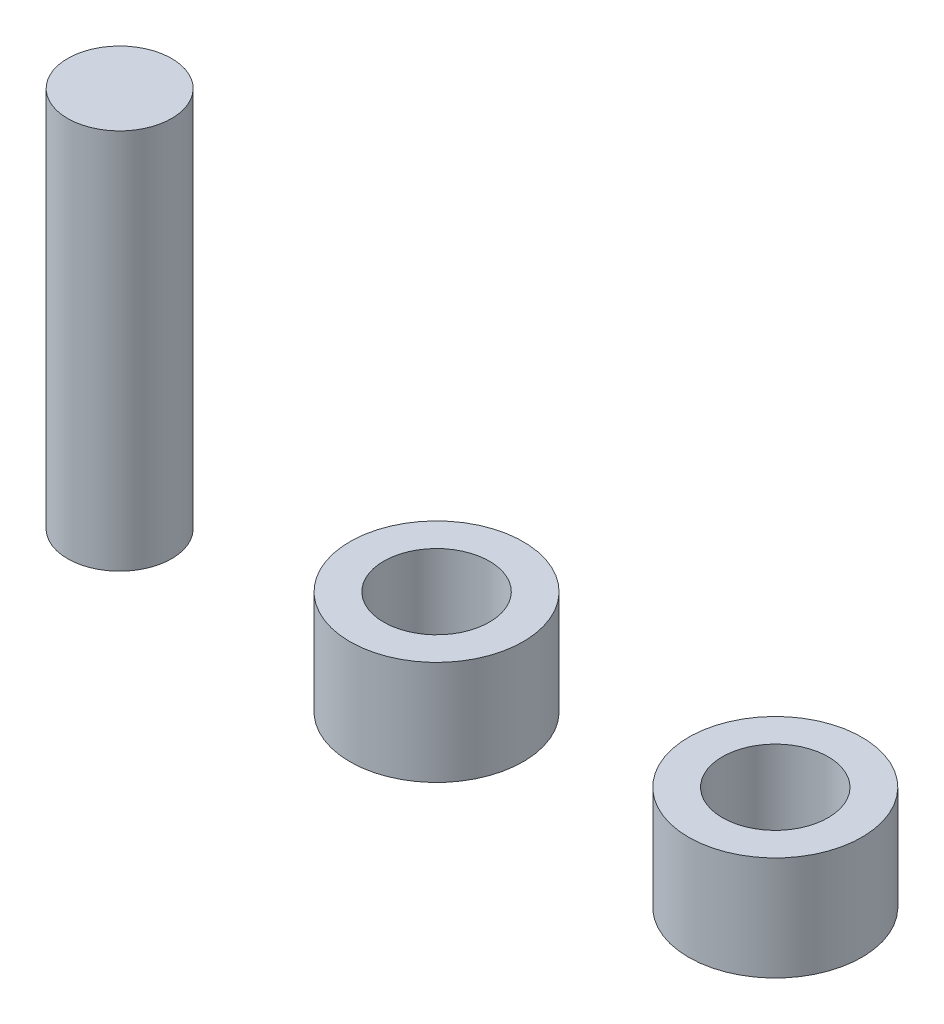
from build123d import *

# Parameters (mm, degrees)
SKETCH1_R           = 2.5
SKETCH1_R_2         = 1.525
BOSS_EXTRUDE1_DEPTH = 3
SKETCH2_R           = 1.5
BOSS_EXTRUDE2_DEPTH = 11


with BuildPart() as part:
    # Sketch1 → Boss-Extrude1 (new body)
    with BuildSketch(Plane(origin=(0, 0, 0), x_dir=(1, 0, 0), z_dir=(0, 1, 0))):
        with Locations(Location((0.114586476, 0, 0), (0, 0, 270))):
            Circle(SKETCH1_R)
        with Locations(Location((0.114586476, 0, 0), (0, 0, 270))):
            Circle(SKETCH1_R_2, mode=Mode.SUBTRACT)
    extrude(amount=BOSS_EXTRUDE1_DEPTH)


with BuildPart() as body_2:
    # Sketch2 → Boss-Extrude2 (new body)
    with BuildSketch(Plane(origin=(0, 0, 0), x_dir=(1, 0, 0), z_dir=(0, 1, 0))):
        with Locations(Location((-9.027296586, 0, 0), (0, 0, 270))):
            Circle(SKETCH2_R)
    extrude(amount=BOSS_EXTRUDE2_DEPTH)


with BuildPart() as body_3:
    # Mirror1: mirrored copy
    add(part.part.mirror(Plane(origin=(5, 0, 0), x_dir=(0, 0, 1), z_dir=(1, 0, 0))))


solid = Compound([part.part, body_2.part, body_3.part])
